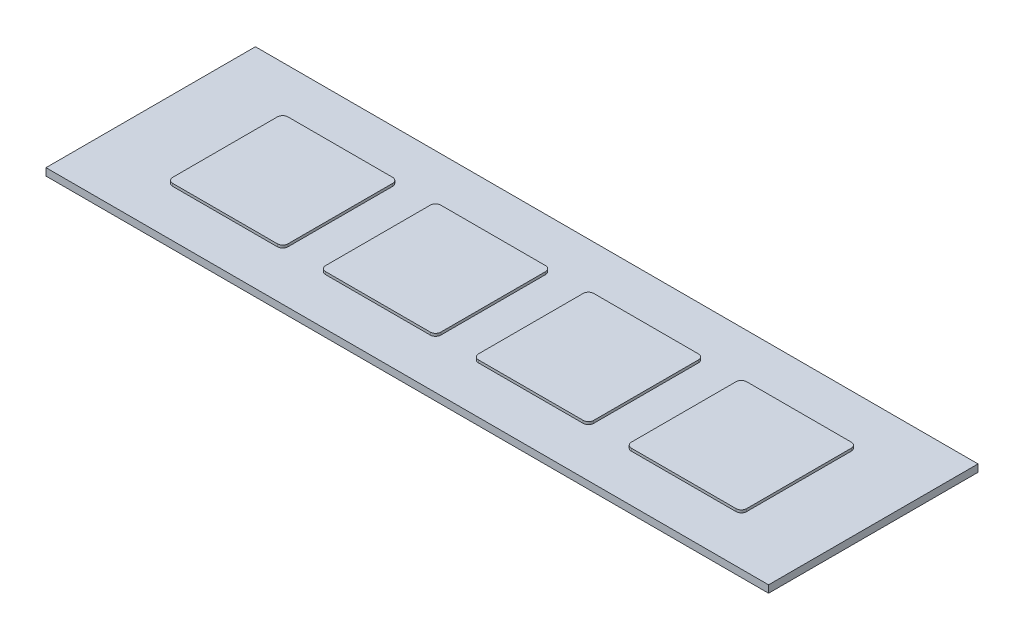
from build123d import *

# Parameters (mm, degrees)
SKETCH1_W           = 69
SKETCH1_H           = 20
BOSS_EXTRUDE1_DEPTH = 0.7
BOSS_EXTRUDE2_DEPTH = 0.25


with BuildPart() as part:
    # Sketch1 → Boss-Extrude1 (new body)
    with BuildSketch(Plane(origin=(0, 0, 0), x_dir=(1, 0, 0), z_dir=(0, 1, 0))):
        Rectangle(SKETCH1_W, SKETCH1_H)
    extrude(amount=BOSS_EXTRUDE1_DEPTH)

    # Sketch2 → Boss-Extrude2 (add)
    with BuildSketch(Plane(origin=(0, 0.7, 0), x_dir=(1, 0, 0), z_dir=(0, 1, 0))):
        with BuildLine():
            Line((-26.9, -5.5), (-16.9, -5.5))
            ThreePointArc((-16.9, -5.5), (-16.546446609, -5.353553391), (-16.4, -5))
            Line((-16.4, -5), (-16.4, 5))
            ThreePointArc((-16.4, 5), (-16.546446609, 5.353553391), (-16.9, 5.5))
            Line((-16.9, 5.5), (-26.9, 5.5))
            ThreePointArc((-26.9, 5.5), (-27.253553391, 5.353553391), (-27.4, 5))
            Line((-27.4, 5), (-27.4, -5))
            ThreePointArc((-27.4, -5), (-27.253553391, -5.353553391), (-26.9, -5.5))
        make_face()
        with BuildLine():
            Line((-12.3, -5.5), (-2.3, -5.5))
            ThreePointArc((-2.3, -5.5), (-1.946446609, -5.353553391), (-1.8, -5))
            Line((-1.8, -5), (-1.8, 5))
            ThreePointArc((-1.8, 5), (-1.946446609, 5.353553391), (-2.3, 5.5))
            Line((-2.3, 5.5), (-12.3, 5.5))
            ThreePointArc((-12.3, 5.5), (-12.653553391, 5.353553391), (-12.8, 5))
            Line((-12.8, 5), (-12.8, -5))
            ThreePointArc((-12.8, -5), (-12.653553391, -5.353553391), (-12.3, -5.5))
        make_face()
        with BuildLine():
            Line((2.3, -5.5), (12.3, -5.5))
            ThreePointArc((12.3, -5.5), (12.653553391, -5.353553391), (12.8, -5))
            Line((12.8, -5), (12.8, 5))
            ThreePointArc((12.8, 5), (12.653553391, 5.353553391), (12.3, 5.5))
            Line((12.3, 5.5), (2.3, 5.5))
            ThreePointArc((2.3, 5.5), (1.946446609, 5.353553391), (1.8, 5))
            Line((1.8, 5), (1.8, -5))
            ThreePointArc((1.8, -5), (1.946446609, -5.353553391), (2.3, -5.5))
        make_face()
        with BuildLine():
            Line((16.9, -5.5), (26.9, -5.5))
            ThreePointArc((26.9, -5.5), (27.253553391, -5.353553391), (27.4, -5))
            Line((27.4, -5), (27.4, 5))
            ThreePointArc((27.4, 5), (27.253553391, 5.353553391), (26.9, 5.5))
            Line((26.9, 5.5), (16.9, 5.5))
            ThreePointArc((16.9, 5.5), (16.546446609, 5.353553391), (16.4, 5))
            Line((16.4, 5), (16.4, -5))
            ThreePointArc((16.4, -5), (16.546446609, -5.353553391), (16.9, -5.5))
        make_face()
    extrude(amount=BOSS_EXTRUDE2_DEPTH)


solid = part.part
